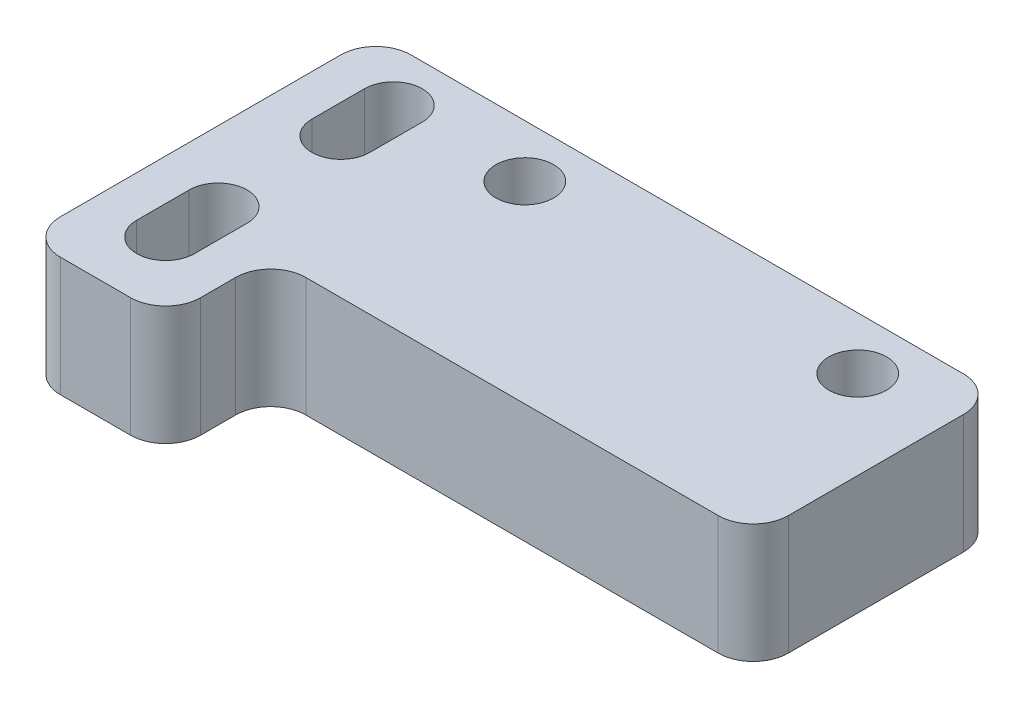
from build123d import *

# Parameters (mm, degrees)
SKETCH1_W               = 27.54
SKETCH1_H               = 6.8
BOSS_EXTRUDE1_DEPTH     = 8
SKETCH4_W               = 27.54
SKETCH4_H               = 6.8
BOSS_EXTRUDE2_DEPTH     = 6
CUT_EXTRUDE2_DEPTH      = 18.316261144
CUT_EXTRUDE2_DEPTH_BACK = 18.316261144
SKETCH3_R               = 1.65
SKETCH7_W               = 8
SKETCH7_H               = 20
BOSS_EXTRUDE3_DEPTH     = 6.8
FILLET1_R               = 2


with BuildPart() as part:
    # Sketch1 → Boss-Extrude1 (new body)
    with BuildSketch(Plane.XY):
        Rectangle(SKETCH1_W, SKETCH1_H)
    extrude(amount=BOSS_EXTRUDE1_DEPTH)

    # Sketch4 → Boss-Extrude2 (add)
    with BuildSketch(Plane(origin=(0, 0, 0), x_dir=(-1, 0, 0), z_dir=(0, 0, -1))):
        Rectangle(SKETCH4_W, SKETCH4_H)
    extrude(amount=BOSS_EXTRUDE2_DEPTH)

    # Sketch3 → Cut-Extrude2 (cut, two sides: drawn at the far end of the back side and taken through both)
    with BuildSketch(Plane.XZ.offset(3.4).offset(-CUT_EXTRUDE2_DEPTH_BACK)):
        with Locations(Location((8.73, -3, 0), (0, 0, 270))):
            Circle(SKETCH3_R)
        with Locations(Location((-10.27, -3, 0), (0, 0, 270))):
            Circle(SKETCH3_R)
    extrude(amount=CUT_EXTRUDE2_DEPTH + CUT_EXTRUDE2_DEPTH_BACK, mode=Mode.SUBTRACT)

    # Sketch7 → Boss-Extrude3 (add)
    with BuildSketch(Plane(origin=(0, 3.4, 0), x_dir=(1, 0, 0), z_dir=(0, 1, 0))):
        with Locations((-17.77, -4)):
            Rectangle(SKETCH7_W, SKETCH7_H)
        with BuildLine():
            Line((-16.12, 3), (-16.12, 0))
            ThreePointArc((-16.12, 0), (-17.77, -1.65), (-19.42, 0))
            Line((-19.42, 0), (-19.42, 3))
            ThreePointArc((-19.42, 3), (-17.77, 4.65), (-16.12, 3))
        make_face(mode=Mode.SUBTRACT)
        with BuildLine():
            Line((-16.12, -7), (-16.12, -10))
            ThreePointArc((-16.12, -10), (-17.77, -11.65), (-19.42, -10))
            Line((-19.42, -10), (-19.42, -7))
            ThreePointArc((-19.42, -7), (-17.77, -5.35), (-16.12, -7))
        make_face(mode=Mode.SUBTRACT)
    extrude(amount=-BOSS_EXTRUDE3_DEPTH)

    # Fillet1
    fillet1_edges = [part.edges().sort_by_distance(p)[0] for p in [
        (13.77, 0, -6),
        (-13.77, 0, 8),
        (-21.77, 0, -6),
        (-21.77, 0, 14),
        (-13.77, 0, 14),
        (13.77, 0, 8),
    ]]
    fillet(fillet1_edges, radius=FILLET1_R)


solid = part.part
